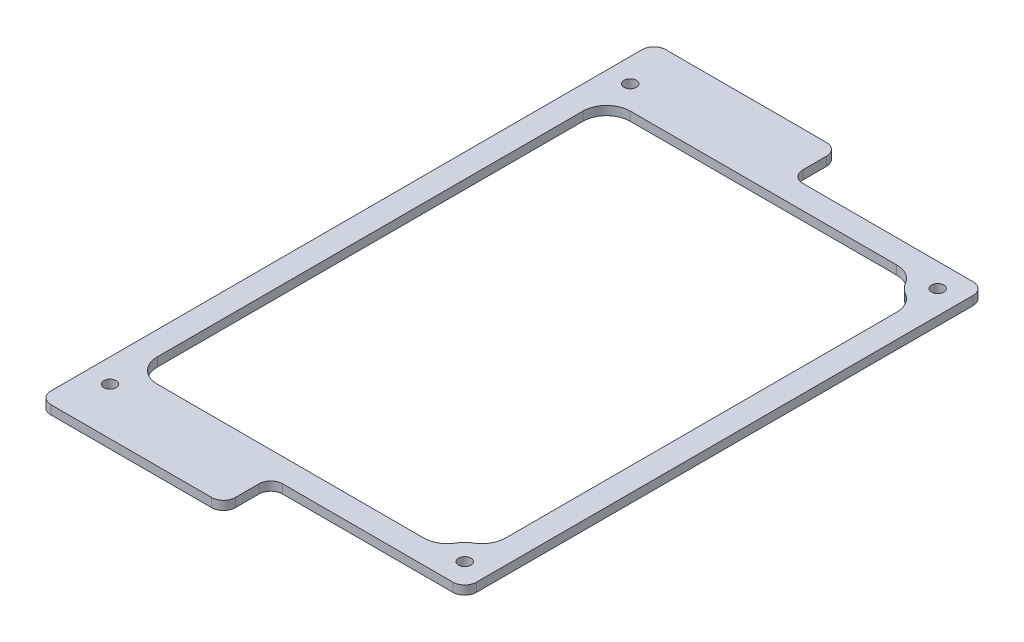
from build123d import *

# Parameters (mm, degrees)
SKETCH1_W                 = 203.2
SKETCH1_H                 = 330.2
BASE_DEPTH                = 4.7625
HOLES_DEPTH               = 194.915578039
HOLES_DEPTH_BACK          = 194.915578039
SKETCH2_R                 = 3.302
SUS_TAB_CUTOUT_DEPTH      = 194.915578039
SUS_TAB_CUTOUT_DEPTH_BACK = 194.915578039
SKETCH3_W                 = 104.14
SKETCH3_H                 = 25.4
INNER_CUTOUT_DEPTH        = 194.915578039
INNER_CUTOUT_DEPTH_BACK   = 194.915578039
FILLET1_R                 = 6.35
FILLET2_R                 = 12.7


with BuildPart() as part:
    # Sketch1 → Base (new body)
    with BuildSketch(Plane(origin=(0, 0, 0), x_dir=(1, 0, 0), z_dir=(0, 1, 0))):
        Rectangle(SKETCH1_W, SKETCH1_H)
    extrude(amount=BASE_DEPTH)

    # Sketch2 → Holes (cut, two sides: drawn at the far end of the back side and taken through both)
    with BuildSketch(Plane(origin=(0, 4.7625, 0), x_dir=(1, 0, 0), z_dir=(0, 1, 0)).offset(-HOLES_DEPTH_BACK)):
        with Locations(Location((-88.9, 139.7, 0), (0, 0, 270))):
            Circle(SKETCH2_R)
        with Locations(Location((-88.9, -139.7, 0), (0, 0, 270))):
            Circle(SKETCH2_R)
        with Locations(Location((88.9, -127, 0), (0, 0, 270))):
            Circle(SKETCH2_R)
        with Locations(Location((88.9, 127, 0), (0, 0, 270))):
            Circle(SKETCH2_R)
    extrude(amount=HOLES_DEPTH + HOLES_DEPTH_BACK, mode=Mode.SUBTRACT)

    # Sketch3 → Sus Tab Cutout (cut, two sides: drawn at the far end of the back side and taken through both)
    with BuildSketch(Plane(origin=(0, 4.7625, 0), x_dir=(1, 0, 0), z_dir=(0, 1, 0)).offset(-SUS_TAB_CUTOUT_DEPTH_BACK)):
        with Locations((49.53, 152.4)):
            Rectangle(SKETCH3_W, SKETCH3_H)
        with Locations((49.53, -152.4)):
            Rectangle(SKETCH3_W, SKETCH3_H)
    extrude(amount=SUS_TAB_CUTOUT_DEPTH + SUS_TAB_CUTOUT_DEPTH_BACK, mode=Mode.SUBTRACT)

    # Sketch4 → Inner Cutout (cut, two sides: drawn at the far end of the back side and taken through both)
    with BuildSketch(Plane(origin=(0, 4.7625, 0), x_dir=(1, 0, 0), z_dir=(0, 1, 0)).offset(-INNER_CUTOUT_DEPTH_BACK)):
        with BuildLine():
            Line((88.9, 114.3), (88.9, -114.3))
            ThreePointArc((88.9, -114.3), (79.919743879, -118.019743879), (76.2, -127))
            Line((76.2, -127), (-88.9, -127))
            Line((-88.9, -127), (-88.9, 127))
            Line((-88.9, 127), (76.2, 127))
            ThreePointArc((76.2, 127), (79.919743879, 118.019743879), (88.9, 114.3))
        make_face()
    extrude(amount=INNER_CUTOUT_DEPTH + INNER_CUTOUT_DEPTH_BACK, mode=Mode.SUBTRACT)

    # Fillet1
    fillet1_edges = [part.edges().sort_by_distance(p)[0] for p in [
        (-2.54, 2.38125, -165.1),
        (101.6, 2.38125, -139.7),
        (-2.54, 2.38125, -139.7),
        (-2.54, 2.38125, 165.1),
        (-2.54, 2.38125, 139.7),
        (101.6, 2.38125, 139.7),
        (-101.6, 2.38125, 165.1),
        (-101.6, 2.38125, -165.1),
    ]]
    fillet(fillet1_edges, radius=FILLET1_R)

    # Fillet2
    fillet2_edges = [part.edges().sort_by_distance(p)[0] for p in [
        (-88.9, 2.38125, -127),
        (76.2, 2.38125, -127),
        (88.9, 2.38125, -114.3),
        (88.9, 2.38125, 114.3),
        (76.2, 2.38125, 127),
        (-88.9, 2.38125, 127),
    ]]
    fillet(fillet2_edges, radius=FILLET2_R)


solid = part.part
